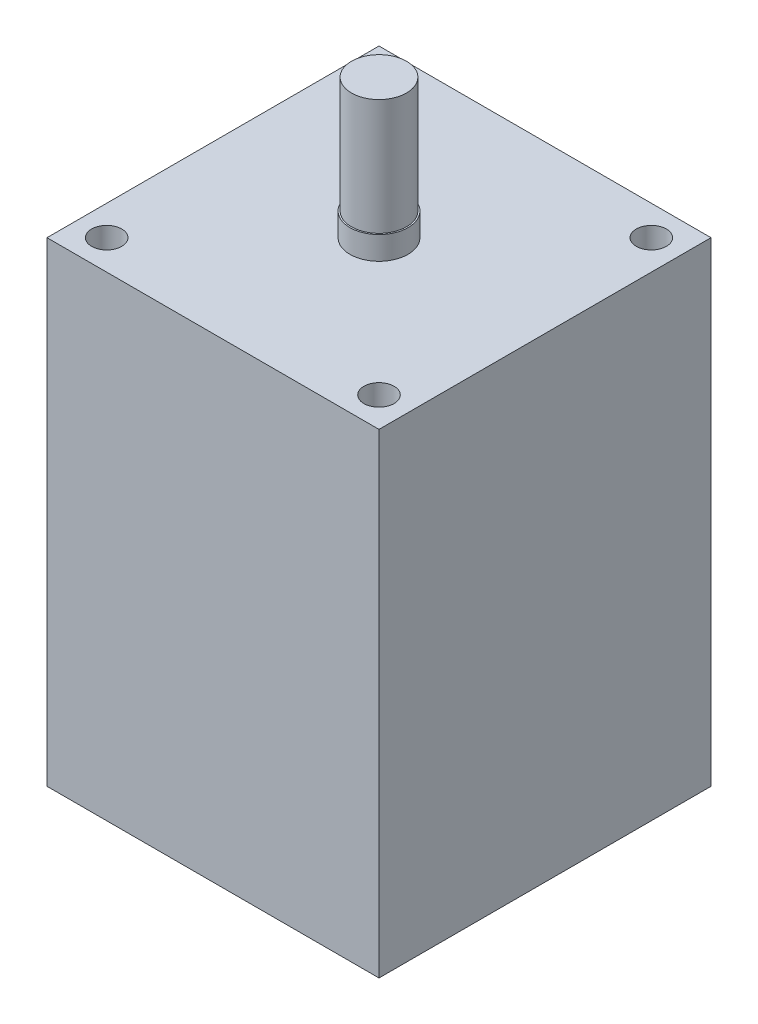
from build123d import *

# Parameters (mm, degrees)
SKETCH1_W           = 57.3
SKETCH1_H           = 57.3
SKETCH1_R           = 5
SKETCH1_R_2         = 2.6
BOSS_EXTRUDE1_DEPTH = 82
BOSS_EXTRUDE2_START = 82
SKETCH1_4_R         = 5
SKETCH1_4_R_2       = 4.75
BOSS_EXTRUDE2_DEPTH = 4
BOSS_EXTRUDE3_START = 82
SKETCH1_5_R         = 4.75
BOSS_EXTRUDE3_DEPTH = 24


with BuildPart() as part:
    # Sketch1 → Boss-Extrude1 (new body)
    with BuildSketch(Plane(origin=(0, 0, 0), x_dir=(1, 0, 0), z_dir=(0, 1, 0))):
        with Locations((28.65, -28.65)):
            Rectangle(SKETCH1_W, SKETCH1_H)
        with Locations(Location((28.65, -28.65, 0), (0, 0, 270))):
            Circle(SKETCH1_R, mode=Mode.SUBTRACT)
        with Locations(Location((52.15, -52.15, 0), (0, 0, 270))):
            Circle(SKETCH1_R_2, mode=Mode.SUBTRACT)
        with Locations(Location((5.15, -52.15, 0), (0, 0, 270))):
            Circle(SKETCH1_R_2, mode=Mode.SUBTRACT)
        with Locations(Location((52.15, -5.15, 0), (0, 0, 270))):
            Circle(SKETCH1_R_2, mode=Mode.SUBTRACT)
        with Locations(Location((5.15, -5.15, 0), (0, 0, 270))):
            Circle(SKETCH1_R_2, mode=Mode.SUBTRACT)
    extrude(amount=BOSS_EXTRUDE1_DEPTH)


with BuildPart() as body_2:
    # Sketch1<4> → Boss-Extrude2 (new body)
    with BuildSketch(Plane(origin=(0, 0, 0), x_dir=(1, 0, 0), z_dir=(0, 1, 0)).offset(BOSS_EXTRUDE2_START)):
        with Locations(Location((28.65, -28.65, 0), (0, 0, 270))):
            Circle(SKETCH1_4_R)
        with Locations(Location((28.65, -28.65, 0), (0, 0, 270))):
            Circle(SKETCH1_4_R_2, mode=Mode.SUBTRACT)
    extrude(amount=BOSS_EXTRUDE2_DEPTH)

    # Sketch1<5> → Boss-Extrude3 (add)
    with BuildSketch(Plane(origin=(0, 0, 0), x_dir=(1, 0, 0), z_dir=(0, 1, 0)).offset(BOSS_EXTRUDE3_START)):
        with Locations(Location((28.65, -28.65, 0), (0, 0, 270))):
            Circle(SKETCH1_5_R)
    extrude(amount=BOSS_EXTRUDE3_DEPTH)


solid = Compound([part.part, body_2.part])
